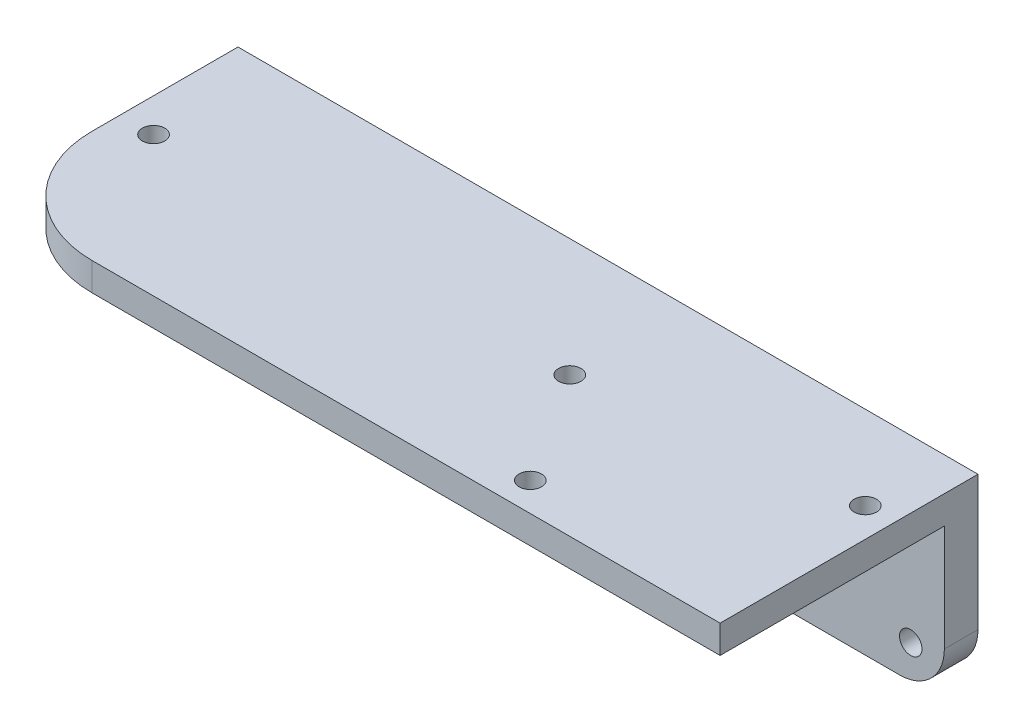
from build123d import *

# Parameters (mm, degrees)
ESBO_O21_W               = 66
ESBO_O21_H               = 16
RESSALTO_EXTRUS_O1_DEPTH = 3
ESBO_O22_W               = 66
ESBO_O22_H               = 2.5
RESSALTO_EXTRUS_O2_DEPTH = 20
ESBO_O23_R               = 1
CORTE_EXTRUS_O9_DEPTH    = 43.429353047
ESBO_O24_R               = 1
ESBO_O24_W               = 12
ESBO_O24_H               = 10
CORTE_EXTRUS_O10_DEPTH   = 40.40812099
FILETE1_R                = 10
FILETE2_R                = 4
FILETE3_R                = 1


with BuildPart() as part:
    # Esboço21 → Ressalto-extrusão1 (new body)
    with BuildSketch(Plane.XY):
        Rectangle(ESBO_O21_W, ESBO_O21_H)
    extrude(amount=RESSALTO_EXTRUS_O1_DEPTH)

    # Esboço22 → Ressalto-extrusão2 (add)
    with BuildSketch(Plane.XY.offset(3)):
        with Locations((0, 6.75)):
            Rectangle(ESBO_O22_W, ESBO_O22_H)
    extrude(amount=RESSALTO_EXTRUS_O2_DEPTH)

    # Esboço23 → Corte-extrusão9 (cut, through all)
    with BuildSketch(Plane.XZ.offset(-5.5)):
        with Locations(Location((-30, 10.53, 0), (0, 0, 270))):
            Circle(ESBO_O23_R)
        with Locations(Location((7.12, 10.53, 0), (0, 0, 270))):
            Circle(ESBO_O23_R)
        with Locations(Location((30.4, 7.45, 0), (0, 0, 270))):
            Circle(ESBO_O23_R)
        with Locations(Location((13.51, 20.44, 0), (0, 0, 270))):
            Circle(ESBO_O23_R)
    extrude(amount=-CORTE_EXTRUS_O9_DEPTH, mode=Mode.SUBTRACT)

    # Esboço24 → Corte-extrusão10 (cut, through all)
    with BuildSketch(Plane.XY.offset(3)):
        with Locations((-30, -5)):
            Circle(ESBO_O24_R)
        with Locations((-11.55315781, 0)):
            Rectangle(ESBO_O24_W, ESBO_O24_H)
    corte_extrus_o10 = extrude(amount=-CORTE_EXTRUS_O10_DEPTH, mode=Mode.SUBTRACT)

    # Filete1
    filete1_edges = [part.edges().sort_by_distance(p)[0] for p in [
        (-33, 6.75, 23),
    ]]
    fillet(filete1_edges, radius=FILETE1_R)

    # Filete2
    filete2_edges = [part.edges().sort_by_distance(p)[0] for p in [
        (33, -8, 1.5),
        (-33, -8, 1.5),
    ]]
    fillet(filete2_edges, radius=FILETE2_R)

    # Espelhar1: Corte-extrusão10 across plane
    add(corte_extrus_o10.mirror(Plane(origin=(0, 0, 0), x_dir=(0, 0, 1), z_dir=(1, 0, 0))), mode=Mode.SUBTRACT)

    # Filete3
    filete3_edges = [part.edges().sort_by_distance(p)[0] for p in [
        (-5.55315781, 5, 1.5),
        (-5.55315781, -5, 1.5),
        (-17.55315781, -5, 1.5),
        (-17.55315781, 5, 1.5),
        (5.55315781, -5, 1.5),
        (5.55315781, 5, 1.5),
        (17.55315781, 5, 1.5),
        (17.55315781, -5, 1.5),
    ]]
    fillet(filete3_edges, radius=FILETE3_R)


solid = part.part
